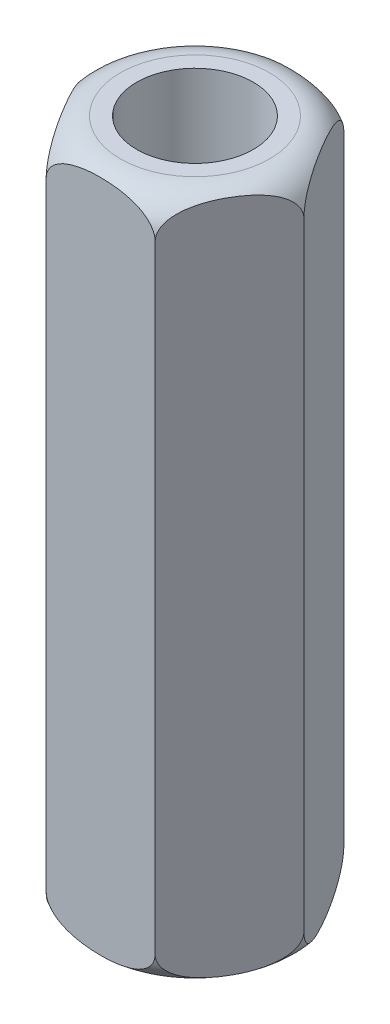
from build123d import *

# Parameters (mm, degrees)
BOSS_EXTRUDE1_DEPTH      = 20
M3_CLEARANCE_HOLE1_D     = 3.4
M3_CLEARANCE_HOLE1_DEPTH = 20
M3_CLEARANCE_HOLE1_TIP   = 1.021463052


with BuildPart() as part:
    # Sketch1 → Boss-Extrude1 (new body)
    with BuildSketch(Plane(origin=(0, 0, 0), x_dir=(1, 0, 0), z_dir=(0, 1, 0))):
        Polygon((3.175426481, 0), (1.58771324, 2.75), (-1.58771324, 2.75), (-3.175426481, 0), (-1.58771324, -2.75), (1.58771324, -2.75), align=None)
    extrude(amount=BOSS_EXTRUDE1_DEPTH)

    # M3 Clearance Hole1
    with Locations(Plane(origin=(0, 20, 0), x_dir=(-1, 0, 0), z_dir=(0, 1, 0))):
        with Locations((0, 0)):
            Hole(M3_CLEARANCE_HOLE1_D / 2, depth=M3_CLEARANCE_HOLE1_DEPTH)
            with Locations((0, 0, -(M3_CLEARANCE_HOLE1_DEPTH + M3_CLEARANCE_HOLE1_TIP / 2))):  # 118° drill point
                Cone(0, M3_CLEARANCE_HOLE1_D / 2, M3_CLEARANCE_HOLE1_TIP, mode=Mode.SUBTRACT)

    # Sketch4 → Cut-Revolve1 (revolve, cut)
    with BuildSketch(Plane.XY, mode=Mode.PRIVATE) as cut_revolve1_sk:
        with BuildLine():
            Line((-2.175426481, 20), (-3.175426481, 20))
            Line((-3.175426481, 20), (-3.175426481, 19))
            ThreePointArc((-3.175426481, 19), (-2.882533262, 19.707106781), (-2.175426481, 20))
        make_face()
        with BuildLine():
            Line((-3.175426481, 1), (-3.175426481, 0))
            Line((-3.175426481, 0), (-2.175426481, 0))
            ThreePointArc((-2.175426481, 0), (-2.882533262, 0.292893219), (-3.175426481, 1))
        make_face()
    revolve(cut_revolve1_sk.sketch.rotate(Axis((0, 20, 0), (0, -1, 0)), 270), axis=Axis((0, 20, 0), (0, -1, 0)), mode=Mode.SUBTRACT)


solid = part.part
